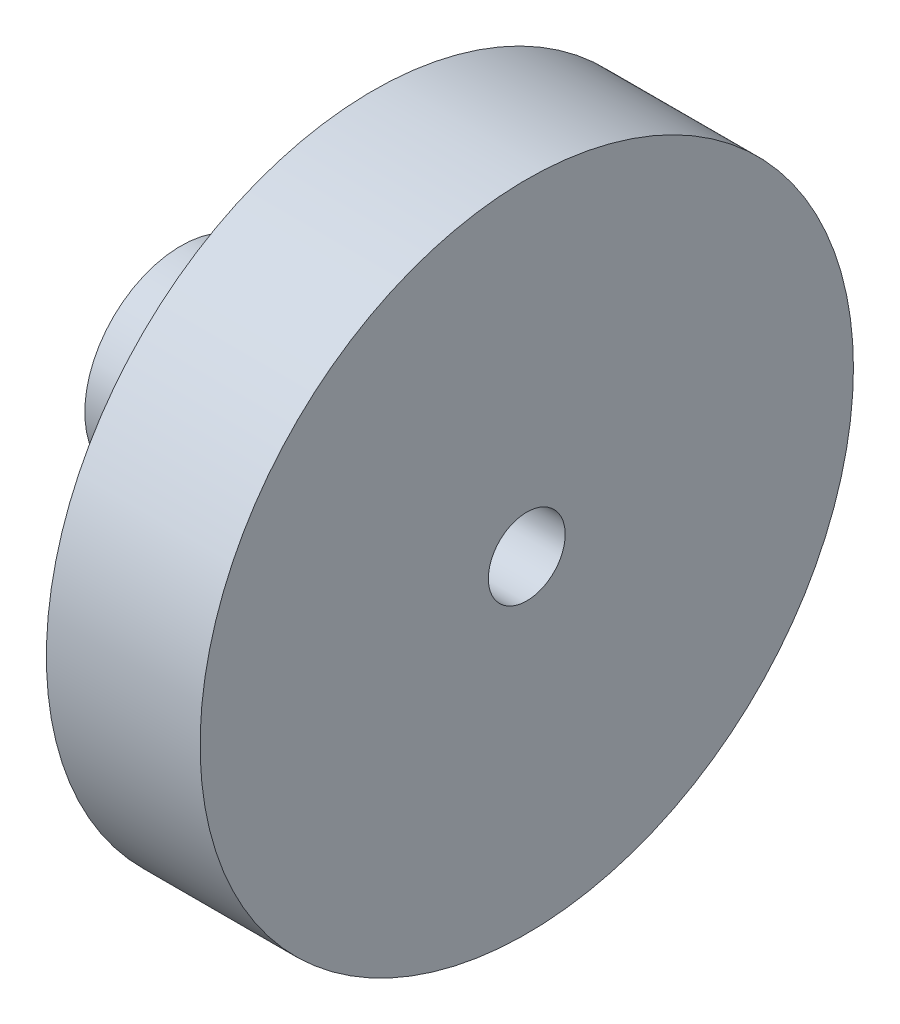
from build123d import *

# Parameters (mm, degrees)
BROCA_DE_ROSQUEAR_PARA_TARRAXA_DE_M2_2X0_REACH = 32.887
BROCA_DE_ROSQUEAR_PARA_TARRAXA_DE_M2_2_R       = 0.875


with BuildPart() as part:
    # Esboço3 → Revolução1 (revolve)
    with BuildSketch(Plane.XY, mode=Mode.PRIVATE) as revolu_o1_sk:
        Polygon((0, 17), (0, 2), (-18, 2), (-18, 5), (-8, 5), (-8, 17), align=None)
    revolve(revolu_o1_sk.sketch.rotate(Axis((0, 0, 0), (-1, 0, 0)), 90), axis=Axis((0, 0, 0), (-1, 0, 0)))

    # Broca de rosquear para tarraxa de M2 2 (on position points) → Broca de rosquear para tarraxa de M2.2x0.451 (cut, up to next)
    with BuildSketch(Plane(origin=(-13.453220178, 5, 0), x_dir=(0, 0, 1), z_dir=(0, 1, 0)), mode=Mode.PRIVATE) as broca_de_rosquear_para_tarraxa_de_m2_2x0_sk1:
        Circle(BROCA_DE_ROSQUEAR_PARA_TARRAXA_DE_M2_2_R)
    broca_de_rosquear_para_tarraxa_de_m2_2x0_tool1 = extrude(broca_de_rosquear_para_tarraxa_de_m2_2x0_sk1.sketch, amount=-BROCA_DE_ROSQUEAR_PARA_TARRAXA_DE_M2_2X0_REACH, mode=Mode.PRIVATE) & part.part
    add(broca_de_rosquear_para_tarraxa_de_m2_2x0_tool1.solids().sort_by_distance((-13.45322, 5, 0))[0], mode=Mode.SUBTRACT)


solid = part.part
